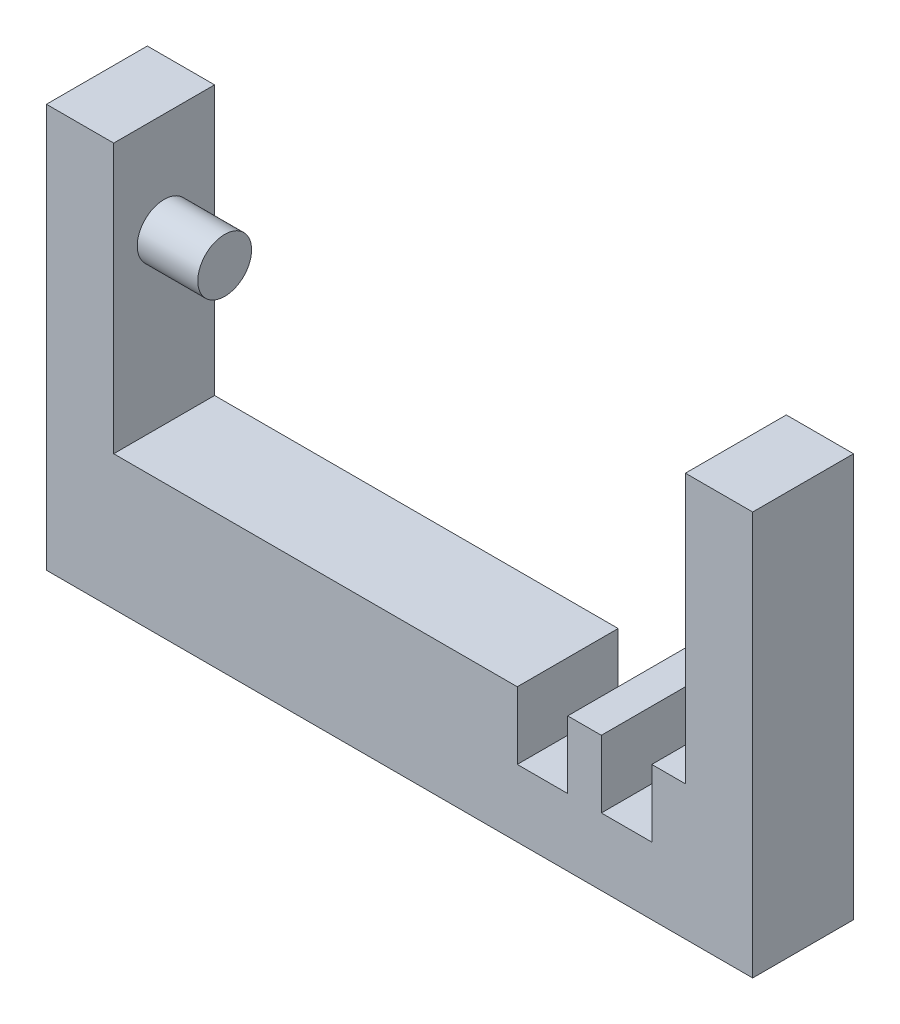
from build123d import *

# Parameters (mm, degrees)
SKETCH1_3_W           = 7.5
SKETCH1_3_H           = 15
BOSS_EXTRUDE2_DEPTH   = 10
BOSS_EXTRUDE2_2_DEPTH = 10
SKETCH1_W             = 5
SKETCH1_H             = 15
SKETCH1_W_2           = 60
BOSS_EXTRUDE3_DEPTH   = 20
SKETCH2_W             = 5
SKETCH2_H             = 5
BOSS_EXTRUDE5_DEPTH   = 5
SKETCH1_9_W           = 10
SKETCH1_9_H           = 15
BOSS_EXTRUDE6_DEPTH   = 60
SKETCH4_R             = 4
BOSS_EXTRUDE7_DEPTH   = 9
SKETCH5_R             = 1.5
CUT_EXTRUDE1_DEPTH    = 5


with BuildPart() as part:
    # Sketch1<3> → Boss-Extrude2 (new body)
    with BuildSketch(Plane(origin=(0, 0, 0), x_dir=(1, 0, 0), z_dir=(0, 1, 0))):
        with Locations((36.25, 0)):
            Rectangle(SKETCH1_3_W, SKETCH1_3_H)
    extrude(amount=BOSS_EXTRUDE2_DEPTH)



with BuildPart() as body_2:
    # Sketch1<3> → Boss-Extrude2 2 (new body)
    with BuildSketch(Plane(origin=(0, 0, 0), x_dir=(1, 0, 0), z_dir=(0, 1, 0))):
        with Locations((23.75, 0)):
            Rectangle(SKETCH1_3_W, SKETCH1_3_H)
    extrude(amount=BOSS_EXTRUDE2_2_DEPTH)


with BuildPart() as part_1:
    add(part.part)

    add(body_2.part)  # Boss-Extrude3 merges body 2
    # Sketch1 → Boss-Extrude3 (add)
    with BuildSketch(Plane(origin=(0, 0, 0), x_dir=(1, 0, 0), z_dir=(0, 1, 0))):
        with Locations((30, 0)):
            Rectangle(SKETCH1_W, SKETCH1_H)
        with Locations((42.5, 0)):
            Rectangle(SKETCH1_W, SKETCH1_H)
        with Locations((-10, 0)):
            Rectangle(SKETCH1_W_2, SKETCH1_H)
    extrude(amount=BOSS_EXTRUDE3_DEPTH)

    # Sketch2 → Boss-Extrude5 (add)
    with BuildSketch(Plane(origin=(0, 0, -7.5), x_dir=(-1, 0, 0), z_dir=(0, 0, -1))):
        with Locations((-30, 17.5)):
            Rectangle(SKETCH2_W, SKETCH2_H)
    extrude(amount=BOSS_EXTRUDE5_DEPTH)

    # Sketch1<9> → Boss-Extrude6 (add)
    with BuildSketch(Plane(origin=(0, 0, 0), x_dir=(1, 0, 0), z_dir=(0, 1, 0))):
        with Locations((50, 0)):
            Rectangle(SKETCH1_9_W, SKETCH1_9_H)
        with Locations((-45, 0)):
            Rectangle(SKETCH1_9_W, SKETCH1_9_H)
    extrude(amount=BOSS_EXTRUDE6_DEPTH)

    # Sketch4 → Boss-Extrude7 (add)
    with BuildSketch(Plane(origin=(-40, 0, 0), x_dir=(0, 0, -1), z_dir=(1, 0, 0))):
        with Locations((0, 45)):
            Circle(SKETCH4_R)
    extrude(amount=BOSS_EXTRUDE7_DEPTH)

    # Sketch5 → Cut-Extrude1 (cut)
    with BuildSketch(Plane(origin=(32.5, 0, 0), x_dir=(0, 0, -1), z_dir=(1, 0, 0))):
        with Locations((10, 17.5)):
            Circle(SKETCH5_R)
    extrude(amount=-CUT_EXTRUDE1_DEPTH, mode=Mode.SUBTRACT)


solid = part_1.part
